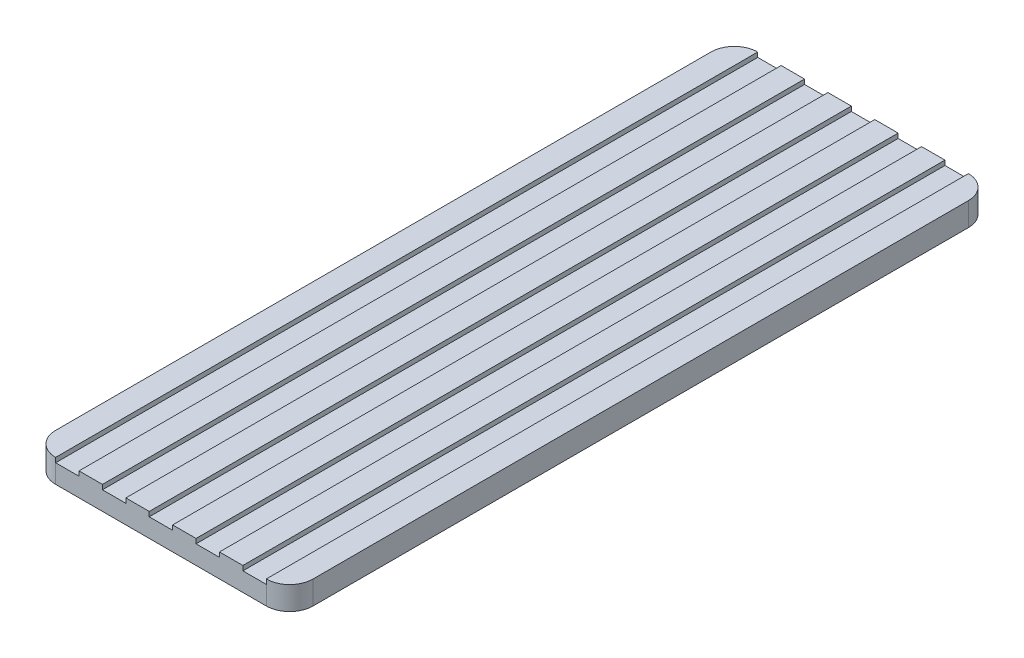
from build123d import *

# Parameters (mm, degrees)
SKETCH2_W           = 55
SKETCH2_H           = 150
BOSS_EXTRUDE1_DEPTH = 5
FILLET1_R           = 5
SKETCH4_W           = 5
SKETCH4_H           = 1
CUT_EXTRUDE1_DEPTH  = 153.581945197
LPATTERN1_COUNT     = 5
LPATTERN1_PITCH     = 10


with BuildPart() as part:
    # Sketch2 → Boss-Extrude1 (new body)
    with BuildSketch(Plane(origin=(0, 0, 0), x_dir=(1, 0, 0), z_dir=(0, 1, 0))):
        Rectangle(SKETCH2_W, SKETCH2_H)
    extrude(amount=BOSS_EXTRUDE1_DEPTH)

    # Fillet1
    fillet1_edges = [part.edges().sort_by_distance(p)[0] for p in [
        (27.5, 2.5, 75),
        (-27.5, 2.5, 75),
        (-27.5, 2.5, -75),
        (27.5, 2.5, -75),
    ]]
    fillet(fillet1_edges, radius=FILLET1_R)

    # Sketch4 → Cut-Extrude1 (cut, through all)
    with BuildSketch(Plane.XY.offset(75)):
        with Locations((-20, 4.5)):
            Rectangle(SKETCH4_W, SKETCH4_H)
    cut_extrude1 = extrude(amount=-CUT_EXTRUDE1_DEPTH, mode=Mode.SUBTRACT)

    # LPattern1: Cut-Extrude1 ×5
    with Locations(*[(i * LPATTERN1_PITCH, 0, 0) for i in range(1, LPATTERN1_COUNT)]):
        add(cut_extrude1, mode=Mode.SUBTRACT)


solid = part.part
